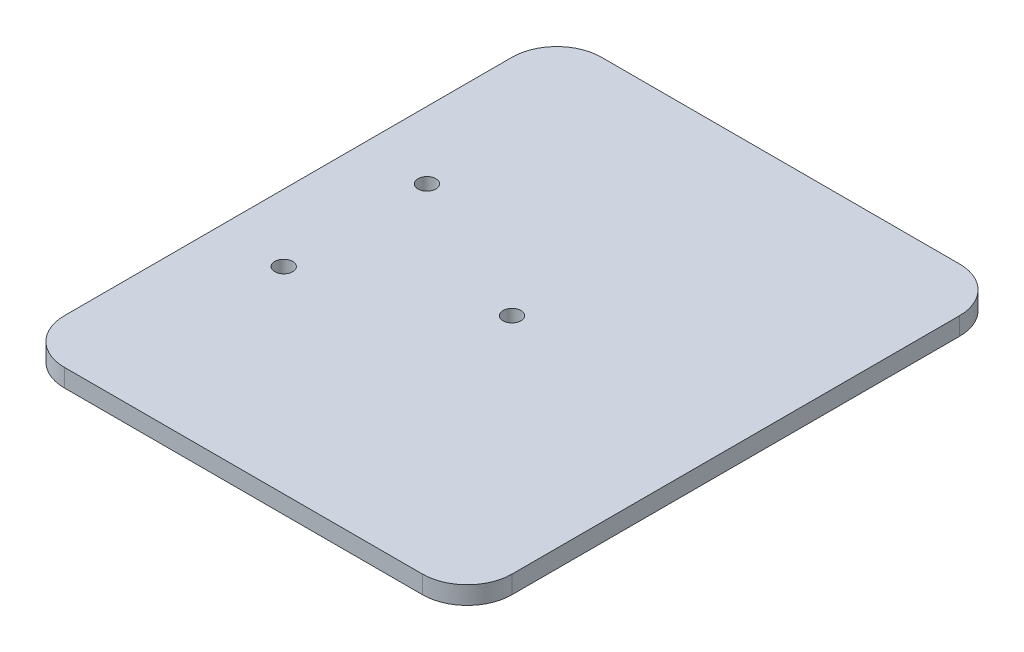
from build123d import *

# Parameters (mm, degrees)
BOSS_EXTRUDE1_DEPTH = 2
SKETCH2_R           = 1
CUT_EXTRUDE1_DEPTH  = 2


with BuildPart() as part:
    # Sketch1 → Boss-Extrude1 (new body)
    with BuildSketch(Plane(origin=(0, 0, 0), x_dir=(1, 0, 0), z_dir=(0, 1, 0))):
        with BuildLine():
            Line((-41.41509434, 11.886792453), (-1.41509434, 11.886792453))
            ThreePointArc((-1.41509434, 11.886792453), (2.120439566, 10.422326359), (3.58490566, 6.886792453))
            Line((3.58490566, 6.886792453), (3.58490566, -43.113207547))
            ThreePointArc((3.58490566, -43.113207547), (2.120439566, -46.648741453), (-1.41509434, -48.113207547))
            Line((-1.41509434, -48.113207547), (-41.41509434, -48.113207547))
            ThreePointArc((-41.41509434, -48.113207547), (-44.950628246, -46.648741453), (-46.41509434, -43.113207547))
            Line((-46.41509434, -43.113207547), (-46.41509434, 6.886792453))
            ThreePointArc((-46.41509434, 6.886792453), (-44.950628246, 10.422326359), (-41.41509434, 11.886792453))
        make_face()
    extrude(amount=BOSS_EXTRUDE1_DEPTH)

    # Sketch2 → Cut-Extrude1 (cut)
    with BuildSketch(Plane(origin=(0, 2, 0), x_dir=(1, 0, 0), z_dir=(0, 1, 0))):
        with Locations(Location((-38.91509434, -10.113207547, 0), (0, 0, 270))):
            Circle(SKETCH2_R)
        with Locations(Location((-38.91509434, -26.113207547, 0), (0, 0, 270))):
            Circle(SKETCH2_R)
        with Locations(Location((-21.41509434, -18.113207547, 0), (0, 0, 270))):
            Circle(SKETCH2_R)
    extrude(amount=-CUT_EXTRUDE1_DEPTH, mode=Mode.SUBTRACT)


solid = part.part
